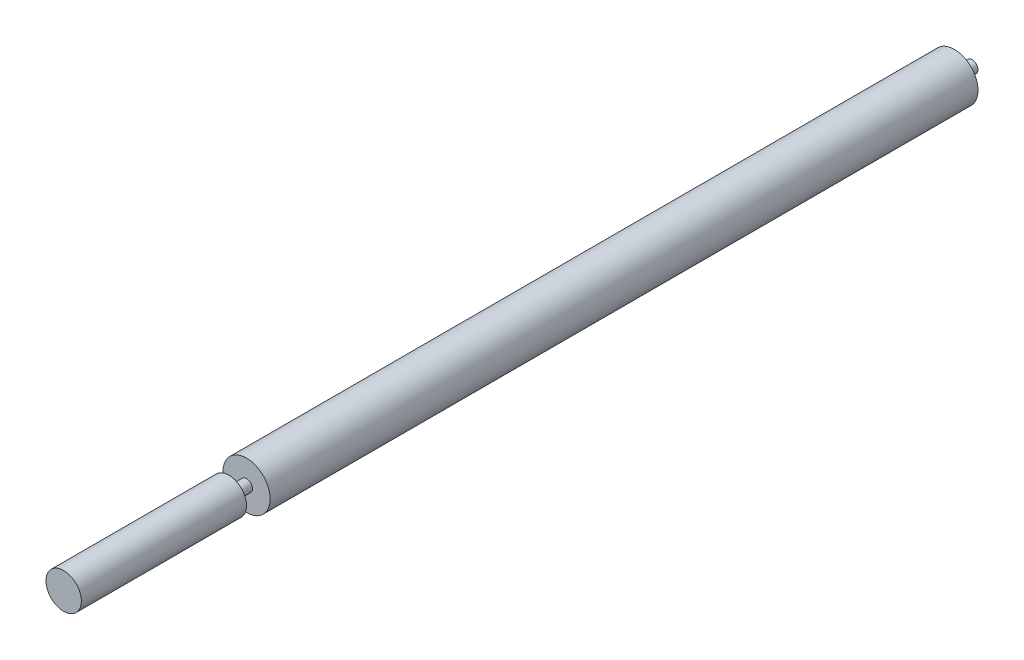
from build123d import *

# Parameters (mm, degrees)
SKETCH1_R           = 6.35
BOSS_EXTRUDE1_DEPTH = 400.05
SKETCH1_3_R         = 25.4
SKETCH1_3_R_2       = 6.35
BOSS_EXTRUDE2_DEPTH = 381
BOSS_EXTRUDE3_START = 19.05
SKETCH3_R           = 19.05
BOSS_EXTRUDE3_DEPTH = 177.8


with BuildPart() as part:
    # Sketch1 → Boss-Extrude1 (new, symmetric)
    with BuildSketch(Plane.XY):
        Circle(SKETCH1_R)
    extrude(amount=BOSS_EXTRUDE1_DEPTH, both=True)

    # Sketch1<3> → Boss-Extrude2 (add, symmetric)
    with BuildSketch(Plane.XY):
        Circle(SKETCH1_3_R)
        Circle(SKETCH1_3_R_2, mode=Mode.SUBTRACT)
    extrude(amount=BOSS_EXTRUDE2_DEPTH, both=True)

    # Sketch3 → Boss-Extrude3 (add)
    with BuildSketch(Plane.XY.offset(381).offset(BOSS_EXTRUDE3_START)):
        Circle(SKETCH3_R)
    extrude(amount=BOSS_EXTRUDE3_DEPTH)


solid = part.part
